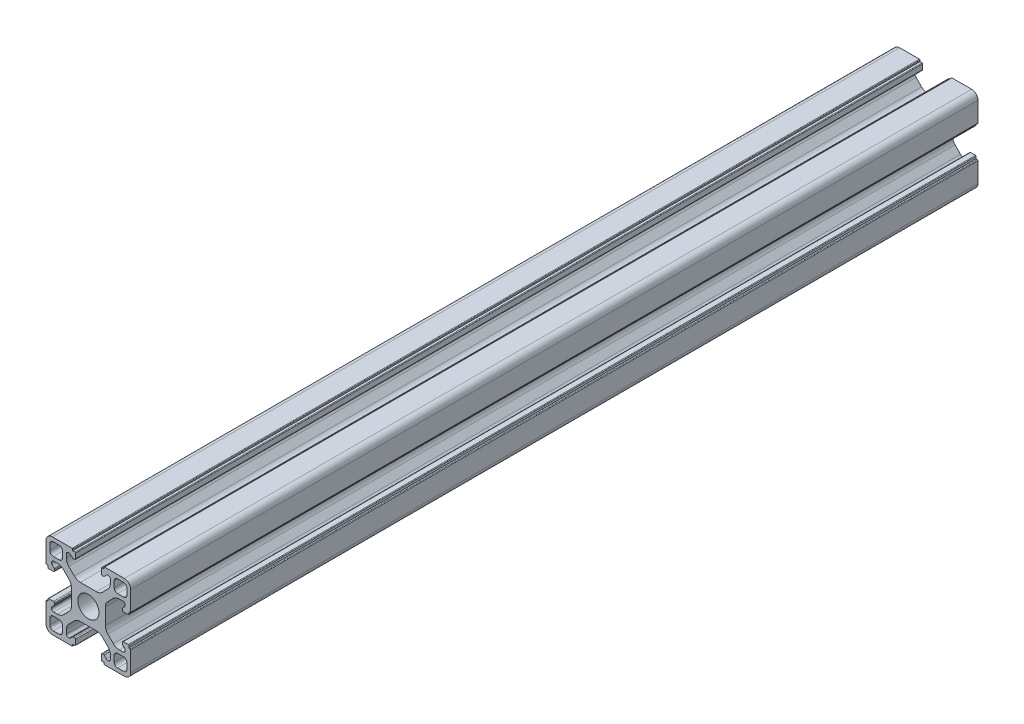
from build123d import *

# Parameters (mm, degrees)
EXTRUDE_1_DEPTH = 200


with BuildPart() as part:
    # Эскиз1 → Бобышка-Вытянуть1 (new body)
    with BuildSketch(Plane.XY):
        with BuildLine():
            Line((-31.105150957, 65.209647948), (-29.206370287, 65.209647948))
            ThreePointArc((-29.206370287, 65.209647948), (-28.441003423, 65.361888883), (-27.792156725, 65.795434385))
            Line((-27.792156725, 65.795434385), (-26.490937394, 67.096653716))
            ThreePointArc((-26.490937394, 67.096653716), (-26.057391892, 67.745500414), (-25.905150957, 68.510867279))
            Line((-25.905150957, 68.510867279), (-25.905150957, 69.409647948))
            ThreePointArc((-25.905150957, 69.409647948), (-26.051597566, 69.763201338), (-26.405150957, 69.909647948))
            Line((-26.405150957, 69.909647948), (-26.508044175, 69.909647948))
            ThreePointArc((-26.508044175, 69.909647948), (-26.699385892, 69.871587714), (-26.861597566, 69.763201338))
            Line((-26.861597566, 69.763201338), (-27.341927652, 69.282871252))
            ThreePointArc((-27.341927652, 69.282871252), (-27.423033489, 69.228678065), (-27.518704347, 69.209647948))
            Line((-27.518704347, 69.209647948), (-27.805150957, 69.209647948))
            ThreePointArc((-27.805150957, 69.209647948), (-27.981927652, 69.282871252), (-28.055150957, 69.459647948))
            Line((-28.055150957, 69.459647948), (-28.055150957, 70.608718768))
            ThreePointArc((-28.055150957, 70.608718768), (-28.011216974, 70.714784785), (-27.905150957, 70.758718768))
            Line((-27.905150957, 70.758718768), (-27.405150957, 70.758718768))
            Line((-27.405150957, 70.758718768), (-27.405150957, 71.059647948))
            ThreePointArc((-27.405150957, 71.059647948), (-27.361216974, 71.165713965), (-27.255150957, 71.209647948))
            Line((-27.255150957, 71.209647948), (-22.605150957, 71.209647948))
            ThreePointArc((-22.605150957, 71.209647948), (-21.544490785, 70.770308119), (-21.105150957, 69.709647948))
            Line((-21.105150957, 69.709647948), (-21.105150957, 65.059647948))
            ThreePointArc((-21.105150957, 65.059647948), (-21.149084939, 64.953581931), (-21.255150957, 64.909647948))
            Line((-21.255150957, 64.909647948), (-21.556080136, 64.909647948))
            Line((-21.556080136, 64.909647948), (-21.556080136, 64.409647948))
            ThreePointArc((-21.556080136, 64.409647948), (-21.600014119, 64.303581931), (-21.706080136, 64.259647948))
            Line((-21.706080136, 64.259647948), (-22.855150957, 64.259647948))
            ThreePointArc((-22.855150957, 64.259647948), (-23.031927652, 64.332871252), (-23.105150957, 64.509647948))
            Line((-23.105150957, 64.509647948), (-23.105150957, 64.796094557))
            ThreePointArc((-23.105150957, 64.796094557), (-23.08612084, 64.891765415), (-23.031927652, 64.972871252))
            Line((-23.031927652, 64.972871252), (-22.551597566, 65.453201338))
            ThreePointArc((-22.551597566, 65.453201338), (-22.44321119, 65.615413013), (-22.405150957, 65.806754729))
            Line((-22.405150957, 65.806754729), (-22.405150957, 65.909647948))
            ThreePointArc((-22.405150957, 65.909647948), (-22.551597566, 66.263201338), (-22.905150957, 66.409647948))
            Line((-22.905150957, 66.409647948), (-23.803931626, 66.409647948))
            ThreePointArc((-23.803931626, 66.409647948), (-24.56929849, 66.257407013), (-25.218145188, 65.82386151))
            Line((-25.218145188, 65.82386151), (-26.519364519, 64.522642179))
            ThreePointArc((-26.519364519, 64.522642179), (-26.952910022, 63.873795482), (-27.105150957, 63.108428617))
            Line((-27.105150957, 63.108428617), (-27.105150957, 61.209647948))
            Line((-27.105150957, 61.209647948), (-27.105150957, 59.310867279))
            ThreePointArc((-27.105150957, 59.310867279), (-26.952910022, 58.545500414), (-26.519364519, 57.896653716))
            Line((-26.519364519, 57.896653716), (-25.218145188, 56.595434385))
            ThreePointArc((-25.218145188, 56.595434385), (-24.56929849, 56.161888883), (-23.803931626, 56.009647948))
            Line((-23.803931626, 56.009647948), (-22.905150957, 56.009647948))
            ThreePointArc((-22.905150957, 56.009647948), (-22.551597566, 56.156094557), (-22.405150957, 56.509647948))
            Line((-22.405150957, 56.509647948), (-22.405150957, 56.612541166))
            ThreePointArc((-22.405150957, 56.612541166), (-22.44321119, 56.803882883), (-22.551597566, 56.966094557))
            Line((-22.551597566, 56.966094557), (-23.031927652, 57.446424643))
            ThreePointArc((-23.031927652, 57.446424643), (-23.08612084, 57.52753048), (-23.105150957, 57.623201338))
            Line((-23.105150957, 57.623201338), (-23.105150957, 57.909647948))
            ThreePointArc((-23.105150957, 57.909647948), (-23.031927652, 58.086424643), (-22.855150957, 58.159647948))
            Line((-22.855150957, 58.159647948), (-21.706080136, 58.159647948))
            ThreePointArc((-21.706080136, 58.159647948), (-21.600014119, 58.115713965), (-21.556080136, 58.009647948))
            Line((-21.556080136, 58.009647948), (-21.556080136, 57.509647948))
            Line((-21.556080136, 57.509647948), (-21.255150957, 57.509647948))
            ThreePointArc((-21.255150957, 57.509647948), (-21.149084939, 57.465713965), (-21.105150957, 57.359647948))
            Line((-21.105150957, 57.359647948), (-21.105150957, 52.709647948))
            ThreePointArc((-21.105150957, 52.709647948), (-21.544490785, 51.648987776), (-22.605150957, 51.209647948))
            Line((-22.605150957, 51.209647948), (-27.255150957, 51.209647948))
            ThreePointArc((-27.255150957, 51.209647948), (-27.361216974, 51.253581931), (-27.405150957, 51.359647948))
            Line((-27.405150957, 51.359647948), (-27.405150957, 51.660577127))
            Line((-27.405150957, 51.660577127), (-27.905150957, 51.660577127))
            ThreePointArc((-27.905150957, 51.660577127), (-28.011216974, 51.70451111), (-28.055150957, 51.810577127))
            Line((-28.055150957, 51.810577127), (-28.055150957, 52.959647948))
            ThreePointArc((-28.055150957, 52.959647948), (-27.981927652, 53.136424643), (-27.805150957, 53.209647948))
            Line((-27.805150957, 53.209647948), (-27.518704347, 53.209647948))
            ThreePointArc((-27.518704347, 53.209647948), (-27.423033489, 53.190617831), (-27.341927652, 53.136424643))
            Line((-27.341927652, 53.136424643), (-26.861597566, 52.656094557))
            ThreePointArc((-26.861597566, 52.656094557), (-26.699385892, 52.547708181), (-26.508044175, 52.509647948))
            Line((-26.508044175, 52.509647948), (-26.405150957, 52.509647948))
            ThreePointArc((-26.405150957, 52.509647948), (-26.051597566, 52.656094557), (-25.905150957, 53.009647948))
            Line((-25.905150957, 53.009647948), (-25.905150957, 53.908428617))
            ThreePointArc((-25.905150957, 53.908428617), (-26.057391892, 54.673795482), (-26.490937394, 55.322642179))
            Line((-26.490937394, 55.322642179), (-27.792156725, 56.62386151))
            ThreePointArc((-27.792156725, 56.62386151), (-28.441003423, 57.057407013), (-29.206370287, 57.209647948))
            Line((-29.206370287, 57.209647948), (-31.105150957, 57.209647948))
            Line((-31.105150957, 57.209647948), (-33.003931626, 57.209647948))
            ThreePointArc((-33.003931626, 57.209647948), (-33.76929849, 57.057407013), (-34.418145188, 56.62386151))
            Line((-34.418145188, 56.62386151), (-35.719364519, 55.322642179))
            ThreePointArc((-35.719364519, 55.322642179), (-36.152910022, 54.673795482), (-36.305150957, 53.908428617))
            Line((-36.305150957, 53.908428617), (-36.305150957, 53.009647948))
            ThreePointArc((-36.305150957, 53.009647948), (-36.158704347, 52.656094557), (-35.805150957, 52.509647948))
            Line((-35.805150957, 52.509647948), (-35.702257738, 52.509647948))
            ThreePointArc((-35.702257738, 52.509647948), (-35.510916022, 52.547708181), (-35.348704347, 52.656094557))
            Line((-35.348704347, 52.656094557), (-34.868374261, 53.136424643))
            ThreePointArc((-34.868374261, 53.136424643), (-34.787268424, 53.190617831), (-34.691597566, 53.209647948))
            Line((-34.691597566, 53.209647948), (-34.405150957, 53.209647948))
            ThreePointArc((-34.405150957, 53.209647948), (-34.228374261, 53.136424643), (-34.155150957, 52.959647948))
            Line((-34.155150957, 52.959647948), (-34.155150957, 51.810577127))
            ThreePointArc((-34.155150957, 51.810577127), (-34.199084939, 51.70451111), (-34.305150957, 51.660577127))
            Line((-34.305150957, 51.660577127), (-34.805150957, 51.660577127))
            Line((-34.805150957, 51.660577127), (-34.805150957, 51.359647948))
            ThreePointArc((-34.805150957, 51.359647948), (-34.849084939, 51.253581931), (-34.955150957, 51.209647948))
            Line((-34.955150957, 51.209647948), (-39.605150957, 51.209647948))
            ThreePointArc((-39.605150957, 51.209647948), (-40.665811128, 51.648987776), (-41.105150957, 52.709647948))
            Line((-41.105150957, 52.709647948), (-41.105150957, 57.359647948))
            ThreePointArc((-41.105150957, 57.359647948), (-41.061216974, 57.465713965), (-40.955150957, 57.509647948))
            Line((-40.955150957, 57.509647948), (-40.654221777, 57.509647948))
            Line((-40.654221777, 57.509647948), (-40.654221777, 58.009647948))
            ThreePointArc((-40.654221777, 58.009647948), (-40.610287794, 58.115713965), (-40.504221777, 58.159647948))
            Line((-40.504221777, 58.159647948), (-39.355150957, 58.159647948))
            ThreePointArc((-39.355150957, 58.159647948), (-39.178374261, 58.086424643), (-39.105150957, 57.909647948))
            Line((-39.105150957, 57.909647948), (-39.105150957, 57.623201338))
            ThreePointArc((-39.105150957, 57.623201338), (-39.124181073, 57.52753048), (-39.178374261, 57.446424643))
            Line((-39.178374261, 57.446424643), (-39.658704347, 56.966094557))
            ThreePointArc((-39.658704347, 56.966094557), (-39.767090723, 56.803882883), (-39.805150957, 56.612541166))
            Line((-39.805150957, 56.612541166), (-39.805150957, 56.509647948))
            ThreePointArc((-39.805150957, 56.509647948), (-39.658704347, 56.156094557), (-39.305150957, 56.009647948))
            Line((-39.305150957, 56.009647948), (-38.406370287, 56.009647948))
            ThreePointArc((-38.406370287, 56.009647948), (-37.641003423, 56.161888883), (-36.992156725, 56.595434385))
            Line((-36.992156725, 56.595434385), (-35.690937394, 57.896653716))
            ThreePointArc((-35.690937394, 57.896653716), (-35.257391892, 58.545500414), (-35.105150957, 59.310867279))
            Line((-35.105150957, 59.310867279), (-35.105150957, 61.209647948))
            Line((-35.105150957, 61.209647948), (-35.105150957, 63.108428617))
            ThreePointArc((-35.105150957, 63.108428617), (-35.257391892, 63.873795482), (-35.690937394, 64.522642179))
            Line((-35.690937394, 64.522642179), (-36.992156725, 65.82386151))
            ThreePointArc((-36.992156725, 65.82386151), (-37.641003423, 66.257407013), (-38.406370287, 66.409647948))
            Line((-38.406370287, 66.409647948), (-39.305150957, 66.409647948))
            ThreePointArc((-39.305150957, 66.409647948), (-39.658704347, 66.263201338), (-39.805150957, 65.909647948))
            Line((-39.805150957, 65.909647948), (-39.805150957, 65.806754729))
            ThreePointArc((-39.805150957, 65.806754729), (-39.767090723, 65.615413013), (-39.658704347, 65.453201338))
            Line((-39.658704347, 65.453201338), (-39.178374261, 64.972871252))
            ThreePointArc((-39.178374261, 64.972871252), (-39.124181073, 64.891765415), (-39.105150957, 64.796094557))
            Line((-39.105150957, 64.796094557), (-39.105150957, 64.509647948))
            ThreePointArc((-39.105150957, 64.509647948), (-39.178374261, 64.332871252), (-39.355150957, 64.259647948))
            Line((-39.355150957, 64.259647948), (-40.504221777, 64.259647948))
            ThreePointArc((-40.504221777, 64.259647948), (-40.610287794, 64.303581931), (-40.654221777, 64.409647948))
            Line((-40.654221777, 64.409647948), (-40.654221777, 64.909647948))
            Line((-40.654221777, 64.909647948), (-40.955150957, 64.909647948))
            ThreePointArc((-40.955150957, 64.909647948), (-41.061216974, 64.953581931), (-41.105150957, 65.059647948))
            Line((-41.105150957, 65.059647948), (-41.105150957, 69.709647948))
            ThreePointArc((-41.105150957, 69.709647948), (-40.665811128, 70.770308119), (-39.605150957, 71.209647948))
            Line((-39.605150957, 71.209647948), (-34.955150957, 71.209647948))
            ThreePointArc((-34.955150957, 71.209647948), (-34.849084939, 71.165713965), (-34.805150957, 71.059647948))
            Line((-34.805150957, 71.059647948), (-34.805150957, 70.758718768))
            Line((-34.805150957, 70.758718768), (-34.305150957, 70.758718768))
            ThreePointArc((-34.305150957, 70.758718768), (-34.199084939, 70.714784785), (-34.155150957, 70.608718768))
            Line((-34.155150957, 70.608718768), (-34.155150957, 69.459647948))
            ThreePointArc((-34.155150957, 69.459647948), (-34.228374261, 69.282871252), (-34.405150957, 69.209647948))
            Line((-34.405150957, 69.209647948), (-34.691597566, 69.209647948))
            ThreePointArc((-34.691597566, 69.209647948), (-34.787268424, 69.228678065), (-34.868374261, 69.282871252))
            Line((-34.868374261, 69.282871252), (-35.348704347, 69.763201338))
            ThreePointArc((-35.348704347, 69.763201338), (-35.510916022, 69.871587714), (-35.702257738, 69.909647948))
            Line((-35.702257738, 69.909647948), (-35.805150957, 69.909647948))
            ThreePointArc((-35.805150957, 69.909647948), (-36.158704347, 69.763201338), (-36.305150957, 69.409647948))
            Line((-36.305150957, 69.409647948), (-36.305150957, 68.510867279))
            ThreePointArc((-36.305150957, 68.510867279), (-36.152910022, 67.745500414), (-35.719364519, 67.096653716))
            Line((-35.719364519, 67.096653716), (-34.418145188, 65.795434385))
            ThreePointArc((-34.418145188, 65.795434385), (-33.76929849, 65.361888883), (-33.003931626, 65.209647948))
            Line((-33.003931626, 65.209647948), (-31.105150957, 65.209647948))
        make_face()
        with BuildLine():
            Line((-24.205150957, 67.309647948), (-22.805150957, 67.309647948))
            ThreePointArc((-22.805150957, 67.309647948), (-22.239465532, 67.543962523), (-22.005150957, 68.109647948))
            Line((-22.005150957, 68.109647948), (-22.005150957, 69.509647948))
            ThreePointArc((-22.005150957, 69.509647948), (-22.239465532, 70.075333373), (-22.805150957, 70.309647948))
            Line((-22.805150957, 70.309647948), (-24.205150957, 70.309647948))
            ThreePointArc((-24.205150957, 70.309647948), (-24.770836381, 70.075333373), (-25.005150957, 69.509647948))
            Line((-25.005150957, 69.509647948), (-25.005150957, 68.109647948))
            ThreePointArc((-25.005150957, 68.109647948), (-24.770836381, 67.543962523), (-24.205150957, 67.309647948))
        make_face(mode=Mode.SUBTRACT)
        with BuildLine():
            Line((-25.005150957, 54.309647948), (-25.005150957, 52.909647948))
            ThreePointArc((-25.005150957, 52.909647948), (-24.770836381, 52.343962523), (-24.205150957, 52.109647948))
            Line((-24.205150957, 52.109647948), (-22.805150957, 52.109647948))
            ThreePointArc((-22.805150957, 52.109647948), (-22.239465532, 52.343962523), (-22.005150957, 52.909647948))
            Line((-22.005150957, 52.909647948), (-22.005150957, 54.309647948))
            ThreePointArc((-22.005150957, 54.309647948), (-22.239465532, 54.875333373), (-22.805150957, 55.109647948))
            Line((-22.805150957, 55.109647948), (-24.205150957, 55.109647948))
            ThreePointArc((-24.205150957, 55.109647948), (-24.770836381, 54.875333373), (-25.005150957, 54.309647948))
        make_face(mode=Mode.SUBTRACT)
        with BuildLine():
            Line((-38.005150957, 55.109647948), (-39.405150957, 55.109647948))
            ThreePointArc((-39.405150957, 55.109647948), (-39.970836381, 54.875333373), (-40.205150957, 54.309647948))
            Line((-40.205150957, 54.309647948), (-40.205150957, 52.909647948))
            ThreePointArc((-40.205150957, 52.909647948), (-39.970836381, 52.343962523), (-39.405150957, 52.109647948))
            Line((-39.405150957, 52.109647948), (-38.005150957, 52.109647948))
            ThreePointArc((-38.005150957, 52.109647948), (-37.439465532, 52.343962523), (-37.205150957, 52.909647948))
            Line((-37.205150957, 52.909647948), (-37.205150957, 54.309647948))
            ThreePointArc((-37.205150957, 54.309647948), (-37.439465532, 54.875333373), (-38.005150957, 55.109647948))
        make_face(mode=Mode.SUBTRACT)
        with BuildLine():
            Line((-37.205150957, 68.109647948), (-37.205150957, 69.509647948))
            ThreePointArc((-37.205150957, 69.509647948), (-37.439465532, 70.075333373), (-38.005150957, 70.309647948))
            Line((-38.005150957, 70.309647948), (-39.405150957, 70.309647948))
            ThreePointArc((-39.405150957, 70.309647948), (-39.970836381, 70.075333373), (-40.205150957, 69.509647948))
            Line((-40.205150957, 69.509647948), (-40.205150957, 68.109647948))
            ThreePointArc((-40.205150957, 68.109647948), (-39.970836381, 67.543962523), (-39.405150957, 67.309647948))
            Line((-39.405150957, 67.309647948), (-38.005150957, 67.309647948))
            ThreePointArc((-38.005150957, 67.309647948), (-37.439465532, 67.543962523), (-37.205150957, 68.109647948))
        make_face(mode=Mode.SUBTRACT)
        with BuildLine():
            ThreePointArc((-28.605150957, 61.209647948), (-29.337384004, 62.977414901), (-31.105150957, 63.709647948))
            ThreePointArc((-31.105150957, 63.709647948), (-32.87291791, 62.977414901), (-33.605150957, 61.209647948))
            ThreePointArc((-33.605150957, 61.209647948), (-32.87291791, 59.441880995), (-31.105150957, 58.709647948))
            ThreePointArc((-31.105150957, 58.709647948), (-29.337384004, 59.441880995), (-28.605150957, 61.209647948))
        make_face(mode=Mode.SUBTRACT)
    extrude(amount=EXTRUDE_1_DEPTH)


solid = part.part
